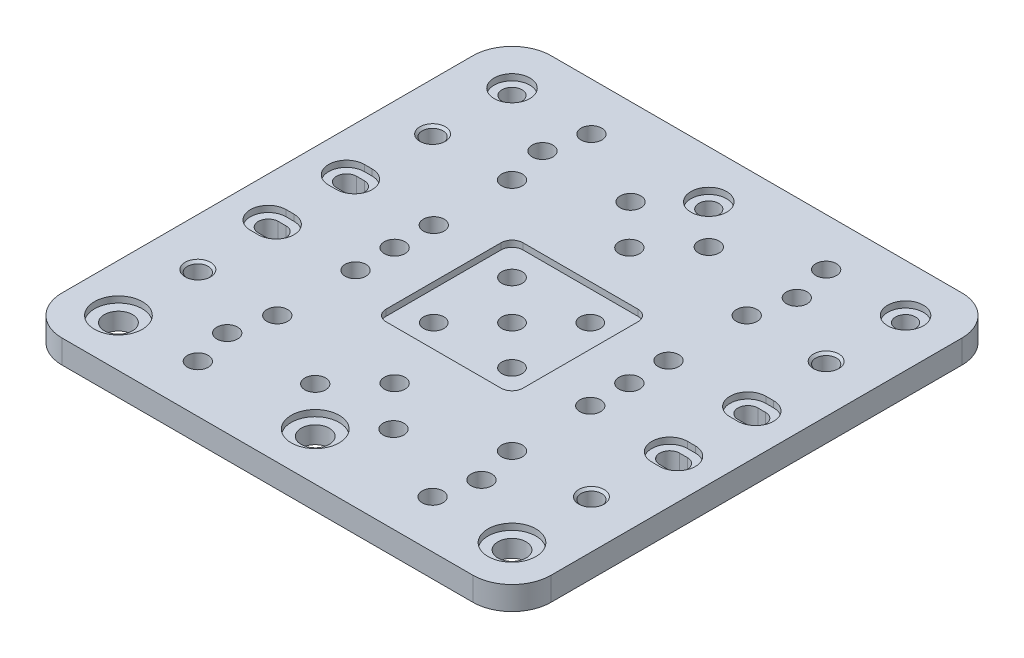
from build123d import *

# Parameters (mm, degrees)
SKETCH1_W                        = 125
SKETCH1_H                        = 125
BOSS_EXTRUDE1_DEPTH              = 6
CBORE_FOR_M6_5_SHSS1_D           = 7.2
CBORE_FOR_M6_5_SHSS1_CBORE_D     = 12.25
CBORE_FOR_M6_5_SHSS1_CBORE_DEPTH = 1.6
HOLE1_D                          = 5.1
HOLE1_DEPTH                      = 6
HOLE1_CBORE_D                    = 9.14
HOLE1_CBORE_DEPTH                = 1.6
HOLE1_TIP                        = 1.532194579
F_5_3_5_3_DIAMETER_HOLE1_D       = 5.3
F_5_3_5_3_DIAMETER_HOLE2_D       = 5.3
CUT_EXTRUDE1_DEPTH               = 1.6
CUT_EXTRUDE2_DEPTH               = 89.497796583
SKETCH16_W                       = 35
SKETCH16_H                       = 35
CUT_EXTRUDE3_DEPTH               = 1.6
F_5_2_5_2_DIAMETER_HOLE1_D       = 5.2
FILLET1_R                        = 10
FILLET2_R                        = 2.8
F_5_3_5_3_DIAMETER_HOLE3_D       = 5.3
CHAMFER1_SIZE                    = 0.6


with BuildPart() as part:
    # Sketch1 → Boss-Extrude1 (new body)
    with BuildSketch(Plane(origin=(0, 0, 0), x_dir=(1, 0, 0), z_dir=(0, 1, 0))):
        Rectangle(SKETCH1_W, SKETCH1_H)
    extrude(amount=BOSS_EXTRUDE1_DEPTH)

    # CBORE for M6.5 SHSS1 (through all)
    with Locations(Plane(origin=(0, 6, 0), x_dir=(1, 0, 0), z_dir=(0, 1, 0))):
        with Locations((-50.3, -50.3), (0, -50.3), (50.3, -50.3)):
            CounterBoreHole(CBORE_FOR_M6_5_SHSS1_D / 2, CBORE_FOR_M6_5_SHSS1_CBORE_D / 2, CBORE_FOR_M6_5_SHSS1_CBORE_DEPTH)

    # Hole1
    with Locations(Plane(origin=(0, 6, 0), x_dir=(1, 0, 0), z_dir=(0, 1, 0))):
        with Locations((-50.3, 50.3), (0, 50.3), (50.3, 50.3)):
            CounterBoreHole(HOLE1_D / 2, HOLE1_CBORE_D / 2, HOLE1_CBORE_DEPTH, depth=HOLE1_DEPTH)
            with Locations((0, 0, -(HOLE1_DEPTH + HOLE1_TIP / 2))):  # 118° drill point
                Cone(0, HOLE1_D / 2, HOLE1_TIP, mode=Mode.SUBTRACT)

    # Ø5.3 (5.3) Diameter Hole1 (through all)
    with Locations(Plane(origin=(0, 6, 0), x_dir=(1, 0, 0), z_dir=(0, 1, 0))):
        with Locations((-30, 50.3), (-32.5, 40.3), (-30, 30), (-10, 40.3), (0, 30), (-30, 10), (-30, 0)):
            Hole(F_5_3_5_3_DIAMETER_HOLE1_D / 2)

    # Ø5.3 (5.3) Diameter Hole2 (through all)
    with Locations(Plane(origin=(0, 6, 0), x_dir=(1, 0, 0), z_dir=(0, 1, 0))):
        with Locations((10, 40.3), (30, 50.3), (32.5, 40.3), (30, 30), (30, 10), (30, 0), (30, -10), (-30, -10), (-30, -30), (0, -30), (30, -30), (10, -40.3), (-10, -40.3), (-32.5, -40.3), (32.5, -40.3), (30, -50.3), (-30, -50.3)):
            Hole(F_5_3_5_3_DIAMETER_HOLE2_D / 2)

    # Sketch13 → Cut-Extrude1 (cut)
    with BuildSketch(Plane(origin=(0, 6, 0), x_dir=(1, 0, 0), z_dir=(0, 1, 0))):
        with BuildLine():
            Line((52.3, 5.43), (50.3, 5.43))
            ThreePointArc((50.3, 5.43), (45.73, 10), (50.3, 14.57))
            Line((50.3, 14.57), (52.3, 14.57))
            ThreePointArc((52.3, 14.57), (56.87, 10), (52.3, 5.43))
        make_face()
        with BuildLine():
            Line((-52.3, 14.57), (-50.3, 14.57))
            ThreePointArc((-50.3, 14.57), (-45.73, 10), (-50.3, 5.43))
            Line((-50.3, 5.43), (-52.3, 5.43))
            ThreePointArc((-52.3, 5.43), (-56.87, 10), (-52.3, 14.57))
        make_face()
        with BuildLine():
            Line((-52.3, -5.43), (-50.3, -5.43))
            ThreePointArc((-50.3, -5.43), (-45.73, -10), (-50.3, -14.57))
            Line((-50.3, -14.57), (-52.3, -14.57))
            ThreePointArc((-52.3, -14.57), (-56.87, -10), (-52.3, -5.43))
        make_face()
        with BuildLine():
            Line((52.3, -14.57), (50.3, -14.57))
            ThreePointArc((50.3, -14.57), (45.73, -10), (50.3, -5.43))
            Line((50.3, -5.43), (52.3, -5.43))
            ThreePointArc((52.3, -5.43), (56.87, -10), (52.3, -14.57))
        make_face()
    extrude(amount=-CUT_EXTRUDE1_DEPTH, mode=Mode.SUBTRACT)

    # Sketch15 → Cut-Extrude2 (cut, through all)
    with BuildSketch(Plane(origin=(0, 4.4, 0), x_dir=(1, 0, 0), z_dir=(0, 1, 0))):
        with BuildLine():
            Line((52.3, 7.45), (50.3, 7.45))
            ThreePointArc((50.3, 7.45), (47.75, 10), (50.3, 12.55))
            Line((50.3, 12.55), (52.3, 12.55))
            ThreePointArc((52.3, 12.55), (54.85, 10), (52.3, 7.45))
        make_face()
        with BuildLine():
            Line((-52.3, 12.55), (-50.3, 12.55))
            ThreePointArc((-50.3, 12.55), (-47.75, 10), (-50.3, 7.45))
            Line((-50.3, 7.45), (-52.3, 7.45))
            ThreePointArc((-52.3, 7.45), (-54.85, 10), (-52.3, 12.55))
        make_face()
        with BuildLine():
            Line((-52.3, -7.45), (-50.3, -7.45))
            ThreePointArc((-50.3, -7.45), (-47.75, -10), (-50.3, -12.55))
            Line((-50.3, -12.55), (-52.3, -12.55))
            ThreePointArc((-52.3, -12.55), (-54.85, -10), (-52.3, -7.45))
        make_face()
        with BuildLine():
            Line((50.3, -7.45), (52.3, -7.45))
            ThreePointArc((52.3, -7.45), (54.85, -10), (52.3, -12.55))
            Line((52.3, -12.55), (50.3, -12.55))
            ThreePointArc((50.3, -12.55), (47.75, -10), (50.3, -7.45))
        make_face()
    extrude(amount=-CUT_EXTRUDE2_DEPTH, mode=Mode.SUBTRACT)

    # Sketch16 → Cut-Extrude3 (cut)
    with BuildSketch(Plane(origin=(0, 6, 0), x_dir=(1, 0, 0), z_dir=(0, 1, 0))):
        Rectangle(SKETCH16_W, SKETCH16_H)
    extrude(amount=-CUT_EXTRUDE3_DEPTH, mode=Mode.SUBTRACT)

    # Ø5.2 (5.2) Diameter Hole1 (through all)
    with Locations(Plane(origin=(0, 4.4, 0), x_dir=(1, 0, 0), z_dir=(0, 1, 0))):
        with Locations((-10, 10), (0, 0), (10, 10), (10, -10), (-10, -10)):
            Hole(F_5_2_5_2_DIAMETER_HOLE1_D / 2)

    # Fillet1
    fillet1_edges = [part.edges().sort_by_distance(p)[0] for p in [
        (62.5, 3, 62.5),
        (-62.5, 3, 62.5),
        (-62.5, 3, -62.5),
        (62.5, 3, -62.5),
    ]]
    fillet(fillet1_edges, radius=FILLET1_R)

    # Fillet2
    fillet2_edges = [part.edges().sort_by_distance(p)[0] for p in [
        (17.5, 5.2, -17.5),
        (17.5, 5.2, 17.5),
        (-17.5, 5.2, 17.5),
        (-17.5, 5.2, -17.5),
    ]]
    fillet(fillet2_edges, radius=FILLET2_R)

    # Ø5.3 (5.3) Diameter Hole3 (through all)
    with Locations(Plane(origin=(0, 6, 0), x_dir=(1, 0, 0), z_dir=(0, 1, 0))):
        with Locations((-50.3, 30), (50.3, 30), (50.3, -30), (-50.3, -30)):
            Hole(F_5_3_5_3_DIAMETER_HOLE3_D / 2)

    # Chamfer1
    chamfer1_edges = [part.edges().sort_by_distance(p)[0] for p in [
        (-47.65, 6, 30),
        (52.95, 6, 30),
        (52.95, 6, -30),
        (-47.65, 6, -30),
    ]]
    chamfer(chamfer1_edges, length=CHAMFER1_SIZE)


solid = part.part
